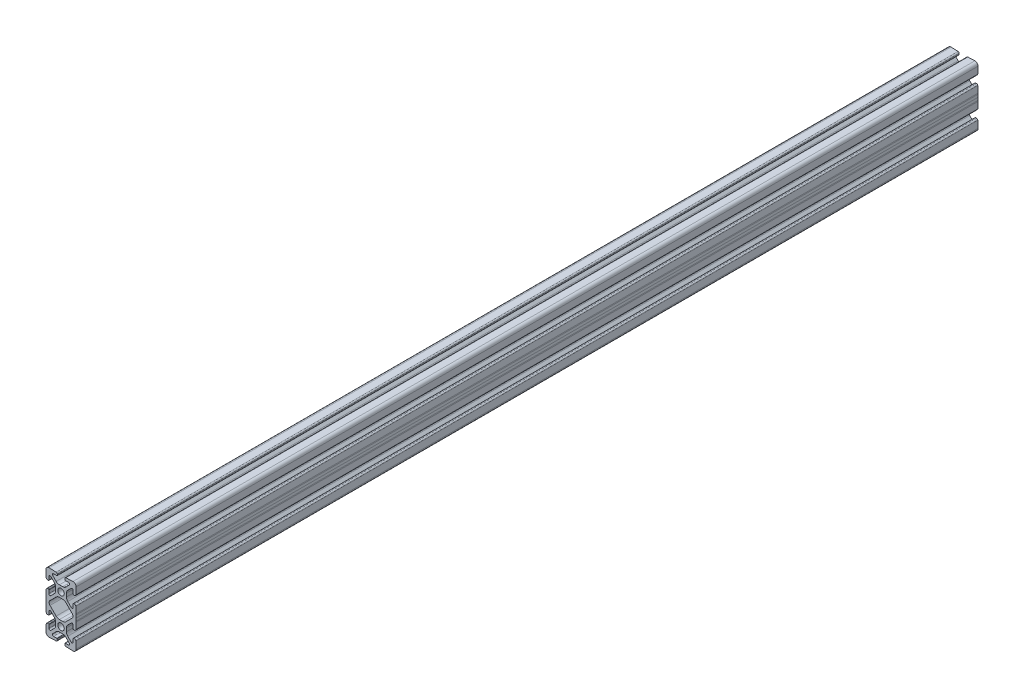
from build123d import *

# Parameters (mm, degrees)
SKETCH3_R               = 2.15
BOSS_EXTRUDE1_DEPTH     = 1524
CIRPATTERN1_COUNT       = 2
CUT_EXTRUDE1_DEPTH      = 10
CUT_EXTRUDE1_DEPTH_BACK = 23
SKETCH4_OUTSIDE_W       = 3659.666
SKETCH4_OUTSIDE_H       = 651.666
SKETCH4_OUTSIDE_W_2     = 600
SKETCH4_OUTSIDE_H_2     = 40


with BuildPart() as part:
    # Sketch3 → Boss-Extrude1 (new, symmetric)
    with BuildSketch(Plane.XY):
        with BuildLine():
            Line((-8.30911066, 7.475083014), (-9.008684239, 7.499512662))
            ThreePointArc((-9.008684239, 7.499512662), (-9.582202525, 7.285082961), (-9.836116498, 6.727919597))
            Line((-9.836116498, 6.727919597), (-9.986803685, 2.412803152))
            ThreePointArc((-9.986803685, 2.412803152), (-9.995837451, 2.069746735), (-9.99898368, 1.726585818))
            Line((-9.99898368, 1.726585818), (-10, 0))
            Line((-10, 0), (-7.916458339, 0))
            ThreePointArc((-7.916458339, 0), (-7.764217404, 0.765366865), (-7.330671901, 1.414213562))
            Line((-7.330671901, 1.414213562), (-3.22356512, 5.521320344))
            ThreePointArc((-3.22356512, 5.521320344), (-2.250295073, 6.171638598), (-1.102244776, 6.4))
            Line((-1.102244776, 6.4), (1.102244776, 6.4))
            ThreePointArc((1.102244776, 6.4), (2.250295073, 6.171638598), (3.22356512, 5.521320344))
            Line((3.22356512, 5.521320344), (7.330671901, 1.414213562))
            ThreePointArc((7.330671901, 1.414213562), (7.764217404, 0.765366865), (7.916458339, 0))
            Line((7.916458339, 0), (10, 0))
            Line((10, 0), (9.99898368, 1.726585818))
            ThreePointArc((9.99898368, 1.726585818), (9.995837451, 2.069746735), (9.986803685, 2.412803152))
            Line((9.986803685, 2.412803152), (9.836116498, 6.727919597))
            ThreePointArc((9.836116498, 6.727919597), (9.582202525, 7.285082961), (9.008684239, 7.499512662))
            Line((9.008684239, 7.499512662), (8.30911066, 7.475083014))
            ThreePointArc((8.30911066, 7.475083014), (8.100174399, 7.379865274), (8.019763261, 7.164795917))
            Line((8.019763261, 7.164795917), (8.093719461, 5.046967452))
            ThreePointArc((8.093719461, 5.046967452), (7.631170264, 4.313871343), (6.779559917, 4.47555462))
            Line((6.779559917, 4.47555462), (4.478679656, 6.77643488))
            ThreePointArc((4.478679656, 6.77643488), (3.828361402, 7.749704927), (3.6, 8.897755224))
            Line((3.6, 8.897755224), (3.6, 11.102244776))
            ThreePointArc((3.6, 11.102244776), (3.828361402, 12.250295073), (4.478679656, 13.22356512))
            Line((4.478679656, 13.22356512), (6.779559917, 15.52444538))
            ThreePointArc((6.779559917, 15.52444538), (7.631170264, 15.686128657), (8.093719461, 14.953032548))
            Line((8.093719461, 14.953032548), (8.019763261, 12.835204083))
            ThreePointArc((8.019763261, 12.835204083), (8.100174399, 12.620134726), (8.30911066, 12.524916986))
            Line((8.30911066, 12.524916986), (9.008684239, 12.500487338))
            ThreePointArc((9.008684239, 12.500487338), (9.582202525, 12.714917039), (9.836116498, 13.272080403))
            Line((9.836116498, 13.272080403), (9.998781654, 17.930201007))
            ThreePointArc((9.998781654, 17.930201007), (9.414213562, 19.414213562), (7.930201007, 19.998781654))
            Line((7.930201007, 19.998781654), (3.272080403, 19.836116498))
            ThreePointArc((3.272080403, 19.836116498), (2.714917039, 19.582202525), (2.500487338, 19.008684239))
            Line((2.500487338, 19.008684239), (2.524916986, 18.30911066))
            ThreePointArc((2.524916986, 18.30911066), (2.620134726, 18.100174399), (2.835204083, 18.019763261))
            Line((2.835204083, 18.019763261), (4.953032548, 18.093719461))
            ThreePointArc((4.953032548, 18.093719461), (5.686128657, 17.631170264), (5.52444538, 16.779559917))
            Line((5.52444538, 16.779559917), (3.22356512, 14.478679656))
            ThreePointArc((3.22356512, 14.478679656), (2.250295073, 13.828361402), (1.102244776, 13.6))
            Line((1.102244776, 13.6), (-1.102244776, 13.6))
            ThreePointArc((-1.102244776, 13.6), (-2.250295073, 13.828361402), (-3.22356512, 14.478679656))
            Line((-3.22356512, 14.478679656), (-5.52444538, 16.779559917))
            ThreePointArc((-5.52444538, 16.779559917), (-5.686128657, 17.631170264), (-4.953032548, 18.093719461))
            Line((-4.953032548, 18.093719461), (-2.835204083, 18.019763261))
            ThreePointArc((-2.835204083, 18.019763261), (-2.620134726, 18.100174399), (-2.524916986, 18.30911066))
            Line((-2.524916986, 18.30911066), (-2.500487338, 19.008684239))
            ThreePointArc((-2.500487338, 19.008684239), (-2.714917039, 19.582202525), (-3.272080403, 19.836116498))
            Line((-3.272080403, 19.836116498), (-7.930201007, 19.998781654))
            ThreePointArc((-7.930201007, 19.998781654), (-9.414213562, 19.414213562), (-9.998781654, 17.930201007))
            Line((-9.998781654, 17.930201007), (-9.836116498, 13.272080403))
            ThreePointArc((-9.836116498, 13.272080403), (-9.582202525, 12.714917039), (-9.008684239, 12.500487338))
            Line((-9.008684239, 12.500487338), (-8.30911066, 12.524916986))
            ThreePointArc((-8.30911066, 12.524916986), (-8.100174399, 12.620134726), (-8.019763261, 12.835204083))
            Line((-8.019763261, 12.835204083), (-8.093719461, 14.953032548))
            ThreePointArc((-8.093719461, 14.953032548), (-7.631170264, 15.686128657), (-6.779559917, 15.52444538))
            Line((-6.779559917, 15.52444538), (-4.478679656, 13.22356512))
            ThreePointArc((-4.478679656, 13.22356512), (-3.828361402, 12.250295073), (-3.6, 11.102244776))
            Line((-3.6, 11.102244776), (-3.6, 8.897755224))
            ThreePointArc((-3.6, 8.897755224), (-3.828361402, 7.749704927), (-4.478679656, 6.77643488))
            Line((-4.478679656, 6.77643488), (-6.779559917, 4.47555462))
            ThreePointArc((-6.779559917, 4.47555462), (-7.631170264, 4.313871343), (-8.093719461, 5.046967452))
            Line((-8.093719461, 5.046967452), (-8.019763261, 7.164795917))
            ThreePointArc((-8.019763261, 7.164795917), (-8.100174399, 7.379865274), (-8.30911066, 7.475083014))
        make_face()
        with Locations((0, 10)):
            Circle(SKETCH3_R, mode=Mode.SUBTRACT)
    boss_extrude1 = extrude(amount=BOSS_EXTRUDE1_DEPTH, both=True)

    # CirPattern1: Boss-Extrude1 ×2 about axis
    cirpattern1_axis = Axis((0, 0, 0), (0, 0, 1))
    for i in range(1, CIRPATTERN1_COUNT):
        add(boss_extrude1.rotate(cirpattern1_axis, i * 360 / CIRPATTERN1_COUNT))

    # Sketch4 outside → Cut-Extrude1 (cut, two sides: drawn at the far end of the back side and taken through both)
    with BuildSketch(Plane(origin=(3.6, 0, 0), x_dir=(0, 0, -1), z_dir=(1, 0, 0)).offset(-CUT_EXTRUDE1_DEPTH_BACK)):
        Rectangle(SKETCH4_OUTSIDE_W, SKETCH4_OUTSIDE_H)
        with Locations((-1224, 0)):
            Rectangle(SKETCH4_OUTSIDE_W_2, SKETCH4_OUTSIDE_H_2, mode=Mode.SUBTRACT)
    extrude(amount=CUT_EXTRUDE1_DEPTH + CUT_EXTRUDE1_DEPTH_BACK, mode=Mode.SUBTRACT)


solid = part.part
